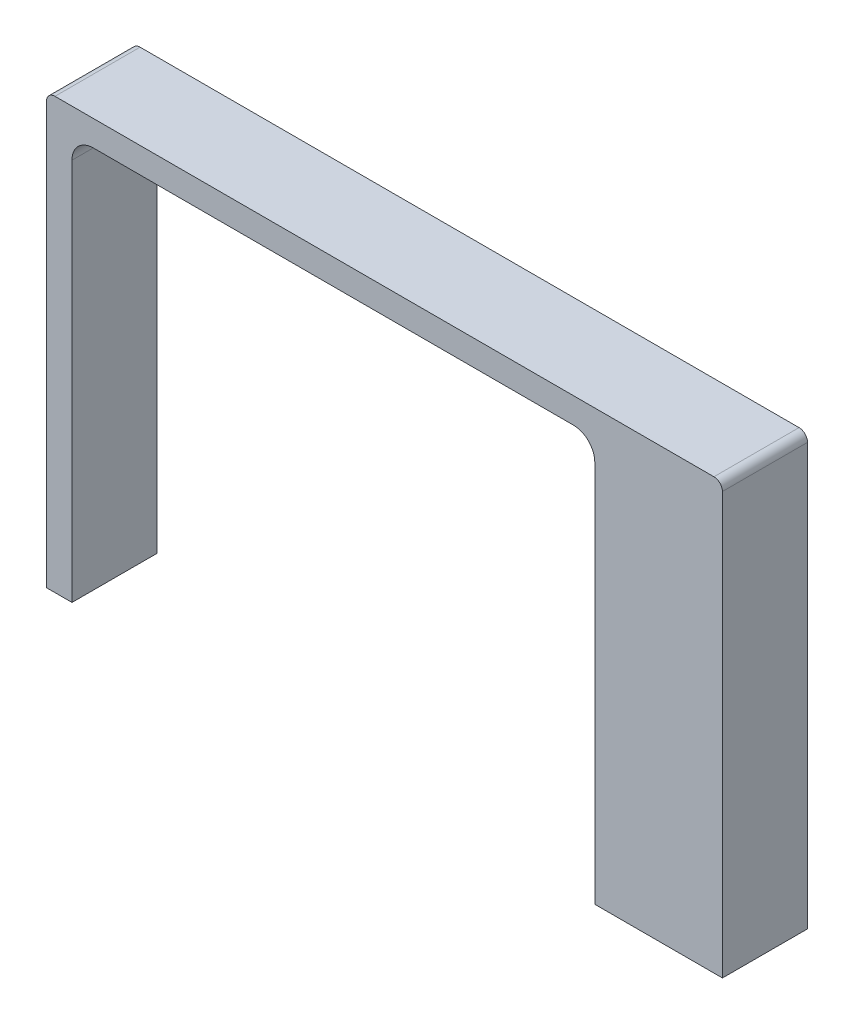
from build123d import *

# Parameters (mm, degrees)
BOSS_EXTRUDE1_DEPTH = 25.4
FILLET1_R           = 6.35
FILLET2_R           = 2.54


with BuildPart() as part:
    # Sketch1 → Boss-Extrude1 (new body)
    with BuildSketch(Plane.XY):
        Polygon((62.7634, -64.135), (100.8634, -64.135), (100.8634, 64.135), (-100.8634, 64.135), (-100.8634, -64.135), (-93.2434, -64.135), (-93.2434, 56.515), (62.7634, 56.515), align=None)
    extrude(amount=BOSS_EXTRUDE1_DEPTH)

    # Fillet1
    fillet1_edges = [part.edges().sort_by_distance(p)[0] for p in [
        (62.7634, 56.515, 12.7),
        (-93.2434, 56.515, 12.7),
    ]]
    fillet(fillet1_edges, radius=FILLET1_R)

    # Fillet2
    fillet2_edges = [part.edges().sort_by_distance(p)[0] for p in [
        (-100.8634, 64.135, 12.7),
        (100.8634, 64.135, 12.7),
    ]]
    fillet(fillet2_edges, radius=FILLET2_R)


solid = part.part
